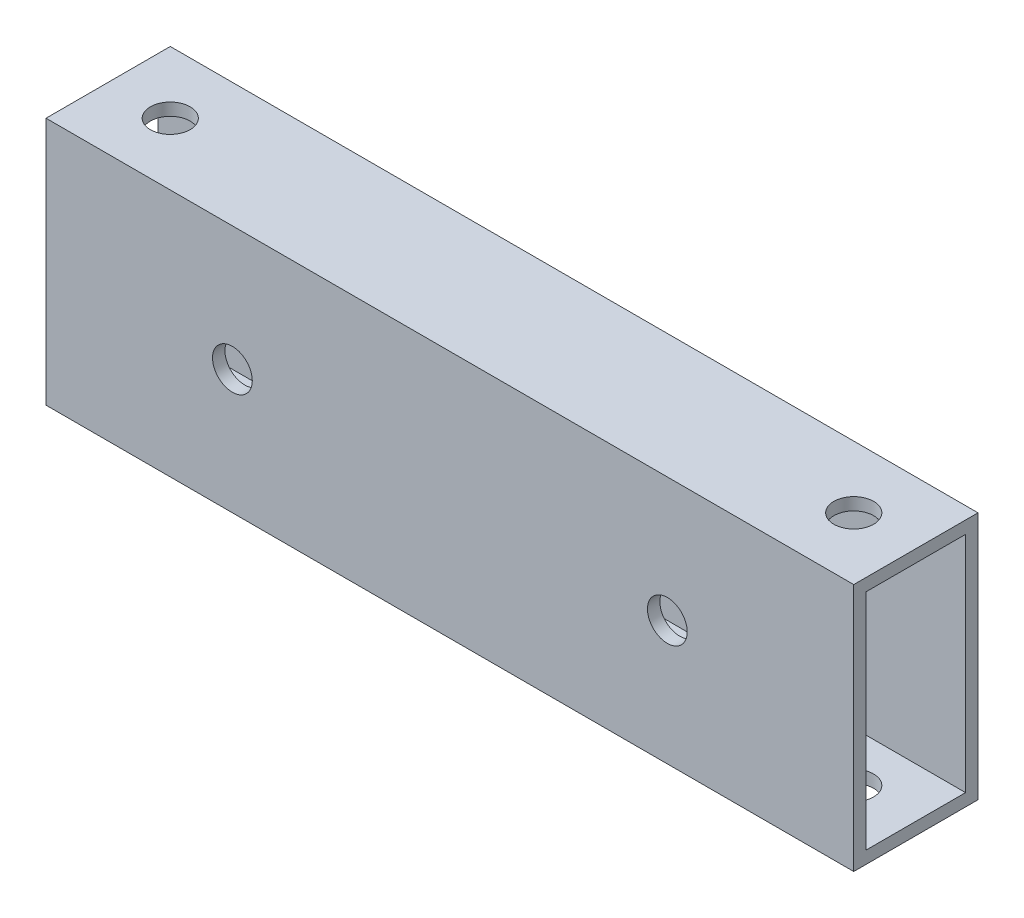
from build123d import *

# Parameters (mm, degrees)
SKETCH_1_W          = 10
SKETCH_1_H          = 20
SKETCH_1_W_2        = 8
SKETCH_1_H_2        = 18
EXTRUDE_1_DEPTH     = 65
SKETCH_2_R          = 1.6
CUT_EXTRUDE_1_DEPTH = 67.520673478
SKETCH_3_R          = 1.6
CUT_EXTRUDE_2_DEPTH = 69.190908485


with BuildPart() as part:
    # ｽｹｯﾁ1 → 押し出し-薄板1 (new body)
    with BuildSketch(Plane(origin=(0, 0, 0), x_dir=(0, 0, -1), z_dir=(1, 0, 0))):
        Rectangle(SKETCH_1_W, SKETCH_1_H)
        Rectangle(SKETCH_1_W_2, SKETCH_1_H_2, mode=Mode.SUBTRACT)
    extrude(amount=EXTRUDE_1_DEPTH)

    # ｽｹｯﾁ2 → ｶｯﾄ - 押し出し1 (cut, through all)
    with BuildSketch(Plane.XY.offset(5)):
        with Locations((15, 0)):
            Circle(SKETCH_2_R)
        with Locations(Location((50, 0, 0), (0, 0, 90))):
            Circle(SKETCH_2_R)
    extrude(amount=-CUT_EXTRUDE_1_DEPTH, mode=Mode.SUBTRACT)

    # ｽｹｯﾁ3 → ｶｯﾄ - 押し出し2 (cut, through all)
    with BuildSketch(Plane(origin=(0, 10, 0), x_dir=(1, 0, 0), z_dir=(0, 1, 0))):
        with Locations(Location((5, 0, 0), (0, 0, 270))):
            Circle(SKETCH_3_R)
        with Locations(Location((60, 0, 0), (0, 0, 270))):
            Circle(SKETCH_3_R)
    extrude(amount=-CUT_EXTRUDE_2_DEPTH, mode=Mode.SUBTRACT)


solid = part.part
